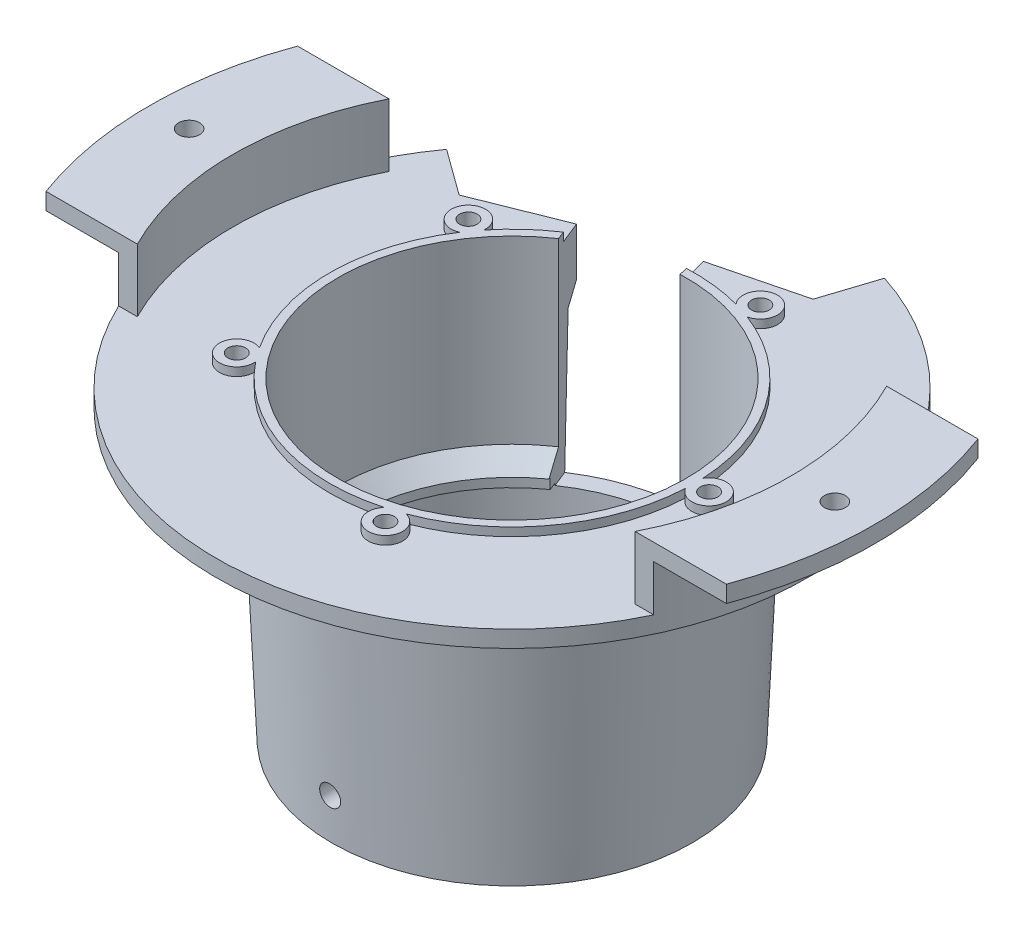
from build123d import *

# Parameters (mm, degrees)
SKETCH2_R               = 2.5
CUT_EXTRUDE3_DEPTH      = 4
CUT_EXTRUDE4_REACH      = 152.402
CUT_EXTRUDE6_DEPTH      = 134.074227407
CUT_EXTRUDE6_DEPTH_BACK = 134.074227407
SKETCH6_R               = 2.5
CUT_EXTRUDE7_REACH      = 135.074
SKETCH7_R               = 2.1
CIRPATTERN1_COUNT       = 5
BOSS_EXTRUDE1_START     = 2
SKETCH8_R               = 41.5
SKETCH8_R_2             = 2.1
BOSS_EXTRUDE1_DEPTH     = 2
CUT_EXTRUDE8_DEPTH      = 135.174326959
CUT_EXTRUDE8_DEPTH_BACK = 50


with BuildPart() as part:
    # Sketch1 → Revolve1 (revolve)
    with BuildSketch(Plane.XY, mode=Mode.PRIVATE) as revolve1_sk:
        Polygon((-70.5, -4), (-70.5, 11), (-86.5, 11), (-86.5, 15), (-66.5, 15), (-66.5, 0), (-41.5, 0), (-41.5, -41), (-37.5, -45), (-38, -45), (-38, -47.5), (-40, -47.5), (-40, -72.5), (-43, -72.5), (-45.5, -15), (-56.5, -4), align=None)
    revolve(revolve1_sk.sketch.rotate(Axis((0, -100.5, 0), (0, 1, 0)), 270), axis=Axis((0, -100.5, 0), (0, 1, 0)))

    # Sketch2 → Cut-Extrude3 (cut)
    with BuildSketch(Plane.XZ.offset(-11)):
        with Locations(Location((77, 0, 0), (0, 0, 270))):
            Circle(SKETCH2_R)
        with Locations(Location((-77, 0, 0), (0, 0, 270))):
            Circle(SKETCH2_R)
    extrude(amount=-CUT_EXTRUDE3_DEPTH, mode=Mode.SUBTRACT)

    # Cut-Extrude4: up to this face of the body (flat: up to its plane)
    cut_extrude4_end = Plane(part.part.faces().sort_by_distance((0, 0, 64.619095962))[0])
    # Sketch3 → Cut-Extrude4 (cut, up to the picked face)
    with BuildSketch(Plane(origin=(0, 15, 0), x_dir=(1, 0, 0), z_dir=(0, 1, 0)), mode=Mode.PRIVATE) as cut_extrude4_sk1:
        with BuildLine():
            Line((-59.348546739, -30), (-81.131066799, -30))
            ThreePointArc((-81.131066799, -30), (0, -86.5), (81.131066799, -30))
            Line((81.131066799, -30), (59.348546739, -30))
            ThreePointArc((59.348546739, -30), (0, -66.5), (-59.348546739, -30))
        make_face()
    cut_extrude4_tool1 = split(extrude(cut_extrude4_sk1.sketch, amount=-CUT_EXTRUDE4_REACH, mode=Mode.PRIVATE), bisect_by=cut_extrude4_end, keep=Keep.BOTH, mode=Mode.PRIVATE)
    # Sketch3 → Cut-Extrude4 (cut, up to the picked face)
    with BuildSketch(Plane(origin=(0, 15, 0), x_dir=(1, 0, 0), z_dir=(0, 1, 0)), mode=Mode.PRIVATE) as cut_extrude4_sk2:
        with BuildLine():
            Line((81.131066799, 30), (59.348546739, 30))
            ThreePointArc((59.348546739, 30), (0, 66.5), (-59.348546739, 30))
            Line((-59.348546739, 30), (-81.131066799, 30))
            ThreePointArc((-81.131066799, 30), (0, 86.5), (81.131066799, 30))
        make_face()
    cut_extrude4_tool2 = split(extrude(cut_extrude4_sk2.sketch, amount=-CUT_EXTRUDE4_REACH, mode=Mode.PRIVATE), bisect_by=cut_extrude4_end, keep=Keep.BOTH, mode=Mode.PRIVATE)
    add(cut_extrude4_tool1.solids().sort_by(Axis((70.239807, 15, 31.718175), (0, -1, 0)))[0], mode=Mode.SUBTRACT)
    add(cut_extrude4_tool2.solids().sort_by(Axis((0, 15, -84.781825), (0, -1, 0)))[0], mode=Mode.SUBTRACT)

    # Sketch6 → Cut-Extrude6 (cut, two sides: drawn at the far end of the back side and taken through both)
    with BuildSketch(Plane.XY.offset(-CUT_EXTRUDE6_DEPTH_BACK)):
        with Locations((0, -62.5)):
            Circle(SKETCH6_R)
    extrude(amount=CUT_EXTRUDE6_DEPTH + CUT_EXTRUDE6_DEPTH_BACK, mode=Mode.SUBTRACT)

    # Cut-Extrude7: up to this cone (the profile starts inside it)
    cut_extrude7_end = Plane(origin=(0, 0, 0), z_dir=(0, 1, 0)).offset(-60.499999) * Cone(1e-06, 256.574, 256.573999, align=(Align.CENTER, Align.CENTER, Align.MIN), mode=Mode.PRIVATE)
    # Sketch7 → Cut-Extrude7 (cut, up to the surface)
    with BuildSketch(Plane(origin=(0, 0, 0), x_dir=(1, 0, 0), z_dir=(0, 1, 0)), mode=Mode.PRIVATE) as cut_extrude7_sk1:
        with Locations(Location((47, 0, 0), (0, 0, 270))):
            Circle(SKETCH7_R)
    cut_extrude7_tool1 = extrude(cut_extrude7_sk1.sketch, amount=-CUT_EXTRUDE7_REACH, mode=Mode.PRIVATE) & cut_extrude7_end
    cut_extrude7 = cut_extrude7_tool1.solids().sort_by_distance((47, 0, 0))[0]
    add(cut_extrude7, mode=Mode.SUBTRACT)

    # CirPattern1: Cut-Extrude7 ×5 about axis
    cirpattern1_axis = Axis((0, 0, 0), (0, 1, 0))
    for i in range(1, CIRPATTERN1_COUNT):
        add(cut_extrude7.rotate(cirpattern1_axis, i * 360 / CIRPATTERN1_COUNT), mode=Mode.SUBTRACT)

    # Sketch8 → Boss-Extrude1 (add)
    with BuildSketch(Plane(origin=(0, 0, 0), x_dir=(1, 0, 0), z_dir=(0, 1, 0)).offset(BOSS_EXTRUDE1_START)):
        with BuildLine():
            ThreePointArc((-33.945803149, -27.20169937), (-26.40364795, -34.57018043), (-17.310153819, -39.907500232))
            ThreePointArc((-17.310153819, -39.907500232), (-3.09320283, -43.389884723), (11.473973908, -41.959479534))
            ThreePointArc((11.473973908, -41.959479534), (15.790768413, -48.598987983), (15.380523379, -40.690164667))
            ThreePointArc((15.380523379, -40.690164667), (35.192239255, -25.568658475), (43.451489362, -2.053794598))
            ThreePointArc((43.451489362, -2.053794598), (51.1, 0), (43.451489362, 2.053794598))
            ThreePointArc((43.451489362, 2.053794598), (35.192239255, 25.568658475), (15.380523379, 40.690164667))
            ThreePointArc((15.380523379, 40.690164667), (15.790768413, 48.598987983), (11.473973908, 41.959479534))
            ThreePointArc((11.473973908, 41.959479534), (-13.442239255, 41.370958459), (-33.945803149, 27.20169937))
            ThreePointArc((-33.945803149, 27.20169937), (-41.340768413, 30.035826392), (-36.3601835, 23.878589904))
            ThreePointArc((-36.3601835, 23.878589904), (-43.5, 0), (-36.3601835, -23.878589904))
            ThreePointArc((-36.3601835, -23.878589904), (-41.340768413, -30.035826392), (-33.945803149, -27.20169937))
        make_face()
        with Locations(Location((0, 0, 0), (0, 0, 90))):
            Circle(SKETCH8_R, mode=Mode.SUBTRACT)
        with Locations(Location((-38.023798736, -27.625906858, 0), (0, 0, 270))):
            Circle(SKETCH8_R_2, mode=Mode.SUBTRACT)
        with Locations(Location((14.523798736, -44.699656266, 0), (0, 0, 270))):
            Circle(SKETCH8_R_2, mode=Mode.SUBTRACT)
        with Locations(Location((47, 0, 0), (0, 0, 270))):
            Circle(SKETCH8_R_2, mode=Mode.SUBTRACT)
        with Locations(Location((14.523798736, 44.699656266, 0), (0, 0, 270))):
            Circle(SKETCH8_R_2, mode=Mode.SUBTRACT)
        with Locations(Location((-38.023798736, 27.625906858, 0), (0, 0, 270))):
            Circle(SKETCH8_R_2, mode=Mode.SUBTRACT)
    extrude(amount=-BOSS_EXTRUDE1_DEPTH)

    # Sketch9 → Cut-Extrude8 (cut, two sides: drawn at the far end of the back side and taken through both)
    with BuildSketch(Plane(origin=(0, 2, 0), x_dir=(1, 0, 0), z_dir=(0, 1, 0)).offset(-CUT_EXTRUDE8_DEPTH_BACK)):
        Polygon((-26.113968679, 41.503759381), (-46.113968679, 33.503759381), (-57.035698103, 41.438860287), (-45.805840693, 62.945404071), (-23.265587716, 71.604116297), (0.059323349, 77.847899239), (21.785698103, 67.049484399), (17.613968679, 54.210221429), (-3.268653226, 48.926652338), (1.719062791, 29.213351352), (-18.561928107, 22.62365795), align=None)
    extrude(amount=CUT_EXTRUDE8_DEPTH + CUT_EXTRUDE8_DEPTH_BACK, mode=Mode.SUBTRACT)


solid = part.part
